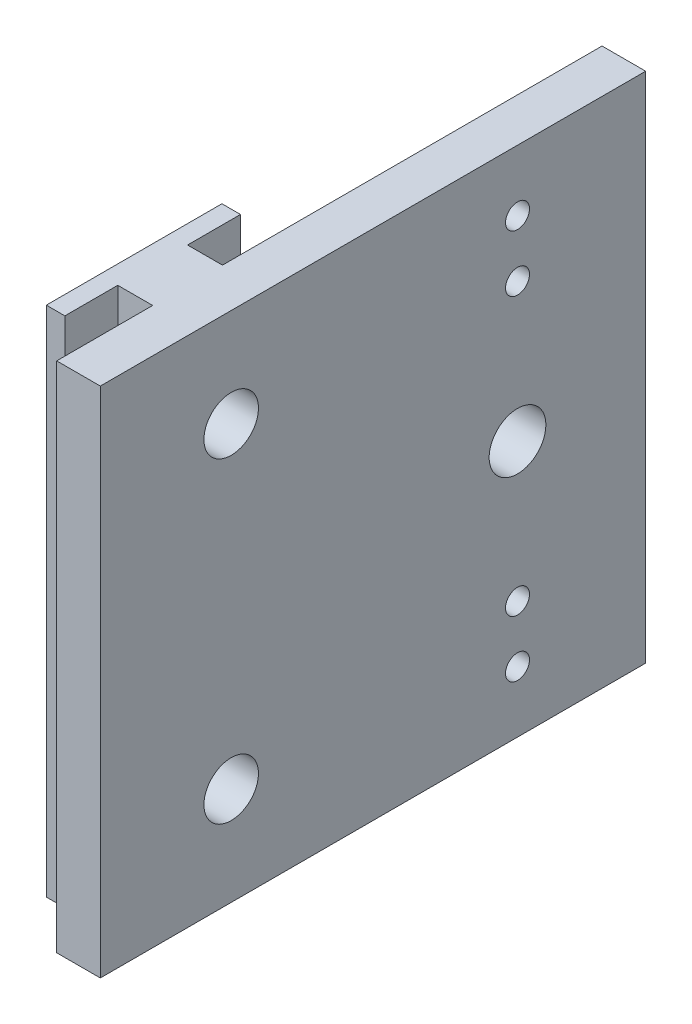
from build123d import *

# Parameters (mm, degrees)
BOSS_EXTRUDE1_DEPTH = 59.69
SKETCH2_R           = 3.302
SKETCH2_R_2         = 1.397
CUT_EXTRUDE1_DEPTH  = 85.326589408
SKETCH3_R           = 3.175
CUT_EXTRUDE2_DEPTH  = 85.326589408
CUT_EXTRUDE3_DEPTH  = 2.06375


with BuildPart() as part:
    # Sketch1 → Boss-Extrude1 (new body)
    with BuildSketch(Plane(origin=(0, 0, 0), x_dir=(1, 0, 0), z_dir=(0, 1, 0))):
        Polygon((0, 0), (0, 20.447), (2.159, 20.447), (2.159, 14.2875), (6.223, 14.2875), (6.223, 58.4835), (11.303, 58.4835), (11.303, -5.0165), (6.223, -5.0165), (6.223, 6.1595), (2.159, 6.1595), (2.159, 0), align=None)
    extrude(amount=BOSS_EXTRUDE1_DEPTH)

    # Sketch2 → Cut-Extrude1 (cut, through all)
    with BuildSketch(Plane(origin=(11.303, 0, 0), x_dir=(0, 0, -1), z_dir=(1, 0, 0))):
        with Locations((43.561, 29.845)):
            Circle(SKETCH2_R)
        with Locations((43.561, 13.716)):
            Circle(SKETCH2_R_2)
        with Locations((43.561, 7.112)):
            Circle(SKETCH2_R_2)
        with Locations((43.561, 45.974)):
            Circle(SKETCH2_R_2)
        with Locations((43.561, 52.578)):
            Circle(SKETCH2_R_2)
    extrude(amount=-CUT_EXTRUDE1_DEPTH, mode=Mode.SUBTRACT)

    # Sketch3 → Cut-Extrude2 (cut, through all)
    with BuildSketch(Plane.ZY):
        with Locations((-10.2235, 48.26)):
            Circle(SKETCH3_R)
        with Locations((-10.2235, 11.43)):
            Circle(SKETCH3_R)
    extrude(amount=-CUT_EXTRUDE2_DEPTH, mode=Mode.SUBTRACT)

    # Sketch4 → Cut-Extrude3 (cut)
    with BuildSketch(Plane.ZY):
        Polygon((-14.7955, 8.790354569), (-14.7955, 14.069645431), (-10.2235, 16.709290861), (-5.6515, 14.069645431), (-5.6515, 8.790354569), (-10.2235, 6.150709139), align=None)
        Polygon((-14.7955, 45.620354569), (-14.7955, 50.899645431), (-10.2235, 53.539290861), (-5.6515, 50.899645431), (-5.6515, 45.620354569), (-10.2235, 42.980709139), align=None)
    extrude(amount=-CUT_EXTRUDE3_DEPTH, mode=Mode.SUBTRACT)


solid = part.part
